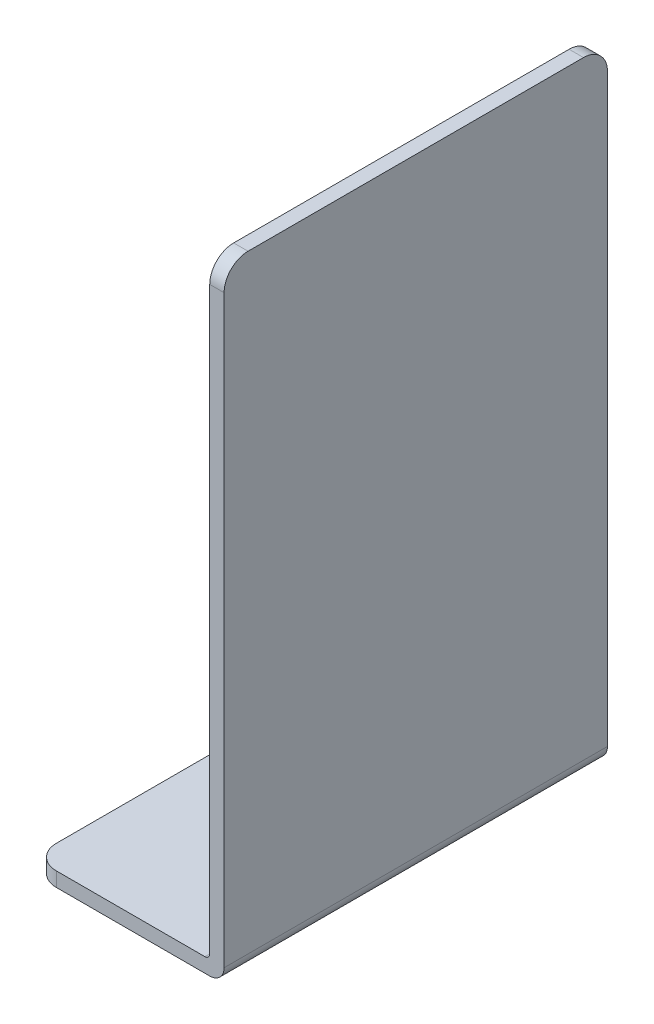
from build123d import *

# Parameters (mm, degrees)
BOSS_EXTRUDE1_DEPTH = 160
FILLET1_R           = 10


with BuildPart() as part:
    # Sketch1 → Boss-Extrude1 (new body)
    with BuildSketch(Plane.XY):
        with BuildLine():
            Line((0, 0), (0, -254))
            ThreePointArc((0, -254), (-1.757359313, -258.242640687), (-6, -260))
            Line((-6, -260), (-80, -260))
            Line((-80, -260), (-80, -254))
            Line((-80, -254), (-8, -254))
            ThreePointArc((-8, -254), (-6.585786438, -253.414213562), (-6, -252))
            Line((-6, -252), (-6, 0))
            Line((-6, 0), (0, 0))
        make_face()
    extrude(amount=BOSS_EXTRUDE1_DEPTH)

    # Fillet1
    fillet1_edges = [part.edges().sort_by_distance(p)[0] for p in [
        (-3, 0, 0),
        (-80, -257, 160),
        (-3, 0, 160),
        (-80, -257, 0),
    ]]
    fillet(fillet1_edges, radius=FILLET1_R)


solid = part.part
